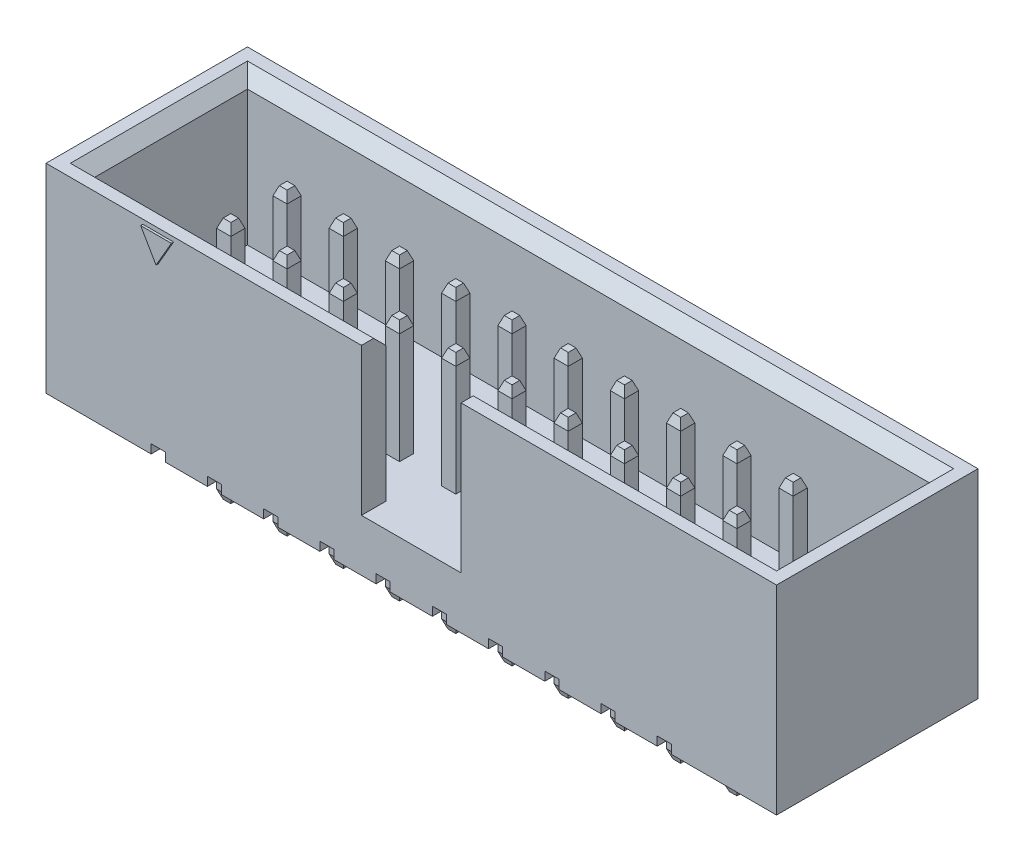
from build123d import *
from OCP.BRepFilletAPI import BRepFilletAPI_MakeChamfer

# Parameters (mm, degrees)
SKETCH1_W                      = 33
SKETCH1_H                      = 9.1
BOSS_EXTRUDE1_DEPTH            = 9
SKETCH2_W                      = 30.8
SKETCH2_H                      = 6.9
CUT_EXTRUDE1_DEPTH             = 6.65
CHAMFER2_SIZE                  = 0.55
CUT_EXTRUDE3_REACH             = 22.882
SKETCH5_W                      = 4.5
SKETCH5_H                      = 6.65
CUT_EXTRUDE3_DIRECTION_2_DEPTH = 21.882049708
SKETCH3_W                      = 0.64
SKETCH3_H                      = 0.64
CUT_EXTRUDE6_DEPTH             = 19.362325561
LPATTERN9_COUNT                = 10
LPATTERN9_PITCH                = 2.54
LPATTERN9_COUNT_DIR2           = 2
LPATTERN9_PITCH_DIR2           = 2.54
BOSS_EXTRUDE3_DEPTH            = 7.75
BOSS_EXTRUDE3_DEPTH_BACK       = 3.25
SKETCH7_W                      = 0.64
SKETCH7_H                      = 0.64
CHAMFER3_SIZE                  = 0.4
CHAMFER3_SIZE2                 = 0.145588094
LPATTERN17_COUNT               = 10
LPATTERN17_PITCH               = 2.54
LPATTERN17_2_COUNT             = 2
LPATTERN17_2_PITCH             = 2.54
SKETCH6_W                      = 0.64
SKETCH6_H                      = 0.4
CUT_EXTRUDE4_DEPTH             = 21.882049708
LPATTERN2_COUNT                = 10
LPATTERN2_PITCH                = 2.54
BOSS_EXTRUDE2_DEPTH            = 0.1


with BuildPart() as part:
    # Sketch1 → Boss-Extrude1 (new body)
    with BuildSketch(Plane(origin=(0, 0, 0), x_dir=(1, 0, 0), z_dir=(0, 1, 0))):
        Rectangle(SKETCH1_W, SKETCH1_H)
    extrude(amount=BOSS_EXTRUDE1_DEPTH)

    # Sketch2 → Cut-Extrude1 (cut)
    with BuildSketch(Plane(origin=(0, 9, 0), x_dir=(1, 0, 0), z_dir=(0, 1, 0))):
        Rectangle(SKETCH2_W, SKETCH2_H)
    extrude(amount=-CUT_EXTRUDE1_DEPTH, mode=Mode.SUBTRACT)

    # Chamfer2
    chamfer2_edges = [part.edges().sort_by_distance(p)[0] for p in [
        (15.4, 9, 0),
        (0, 9, -3.45),
        (-15.4, 9, 0),
        (0, 9, 3.45),
    ]]
    chamfer(chamfer2_edges, length=CHAMFER2_SIZE)

    # Sketch5 → Cut-Extrude3 (cut, up to next)
    with BuildSketch(Plane.XY.offset(4.55), mode=Mode.PRIVATE) as cut_extrude3_sk1:
        with Locations((0, 5.675)):
            Rectangle(SKETCH5_W, SKETCH5_H)
    cut_extrude3_tool1 = extrude(cut_extrude3_sk1.sketch, amount=-CUT_EXTRUDE3_REACH, mode=Mode.PRIVATE) & part.part
    add(cut_extrude3_tool1.solids().sort_by_distance((0, 5.675, 4.55))[0], mode=Mode.SUBTRACT)

    # Sketch5 → Cut-Extrude3 direction 2 (cut)
    with BuildSketch(Plane.XY.offset(4.55)):
        with Locations((0, 5.675)):
            Rectangle(SKETCH5_W, SKETCH5_H)
    extrude(amount=CUT_EXTRUDE3_DIRECTION_2_DEPTH, mode=Mode.SUBTRACT)

    # Sketch3 → Cut-Extrude6 (cut, through all)
    with BuildSketch(Plane(origin=(0, 2.35, 0), x_dir=(1, 0, 0), z_dir=(0, 1, 0))):
        with Locations((-11.43, 1.27)):
            Rectangle(SKETCH3_W, SKETCH3_H)
    cut_extrude6 = extrude(amount=-CUT_EXTRUDE6_DEPTH, mode=Mode.SUBTRACT)

    # LPattern9: Cut-Extrude6 10 × 2
    with Locations(*[(i * LPATTERN9_PITCH, 0, j * LPATTERN9_PITCH_DIR2) for i in range(LPATTERN9_COUNT) for j in range(LPATTERN9_COUNT_DIR2) if (i, j) != (0, 0)]):
        add(cut_extrude6, mode=Mode.SUBTRACT)

    # Sketch6 → Cut-Extrude4 (cut, through all)
    with BuildSketch(Plane.XY.offset(4.55)):
        with Locations((-11.43, 0.2)):
            Rectangle(SKETCH6_W, SKETCH6_H)
    cut_extrude4 = extrude(amount=-CUT_EXTRUDE4_DEPTH, mode=Mode.SUBTRACT)

    # LPattern2: Cut-Extrude4 ×10
    with Locations(*[(i * LPATTERN2_PITCH, 0, 0) for i in range(1, LPATTERN2_COUNT)]):
        add(cut_extrude4, mode=Mode.SUBTRACT)

    # Sketch4 → Boss-Extrude2 (add)
    with BuildSketch(Plane.XY.offset(4.55)):
        Polygon((-12.122820323, 8.8), (-10.737179677, 8.8), (-11.43, 7.6), align=None)
    extrude(amount=BOSS_EXTRUDE2_DEPTH)


with BuildPart() as body_2:
    # Sketch7 → Boss-Extrude3 (new, two sides: drawn at the far end of the back side and taken through both)
    with BuildSketch(Plane(origin=(0, 0, 0), x_dir=(1, 0, 0), z_dir=(0, 1, 0)).offset(-BOSS_EXTRUDE3_DEPTH_BACK)):
        with Locations((-11.43, 1.27)):
            Rectangle(SKETCH7_W, SKETCH7_H)
    extrude(amount=BOSS_EXTRUDE3_DEPTH + BOSS_EXTRUDE3_DEPTH_BACK)

    # Chamfer3: one chamfer whose edges measure the first distance from different faces: ONE call of the kernel's chamfer builder (chamfer() names one face for all edges)
    chamfer3_edges_1 = [body_2.edges().sort_by_distance(p)[0] for p in [
        (-11.75, -3.25, -1.27),
        (-11.75, 7.75, -1.27),
    ]]
    chamfer3_side_1 = [body_2.faces().sort_by_distance(p)[0] for p in [
        (-11.75, 2.25, -1.27),
    ]]
    chamfer3_edges_2 = [body_2.edges().sort_by_distance(p)[0] for p in [
        (-11.11, 7.75, -1.27),
        (-11.11, -3.25, -1.27),
    ]]
    chamfer3_side_2 = [body_2.faces().sort_by_distance(p)[0] for p in [
        (-11.11, 2.25, -1.27),
    ]]
    chamfer3_edges_3 = [body_2.edges().sort_by_distance(p)[0] for p in [
        (-11.43, 7.75, -1.59),
        (-11.43, -3.25, -1.59),
    ]]
    chamfer3_side_3 = [body_2.faces().sort_by_distance(p)[0] for p in [
        (-11.43, 2.25, -1.59),
    ]]
    chamfer3_edges_4 = [body_2.edges().sort_by_distance(p)[0] for p in [
        (-11.43, -3.25, -0.95),
        (-11.43, 7.75, -0.95),
    ]]
    chamfer3_side_4 = [body_2.faces().sort_by_distance(p)[0] for p in [
        (-11.43, 2.25, -0.95),
    ]]
    chamfer3 = BRepFilletAPI_MakeChamfer(body_2.part.solid().wrapped)
    for e in chamfer3_edges_1:
        chamfer3.Add(CHAMFER3_SIZE, CHAMFER3_SIZE2, e.wrapped, chamfer3_side_1[0].wrapped)  # the first distance lies on this face
    for e in chamfer3_edges_2:
        chamfer3.Add(CHAMFER3_SIZE, CHAMFER3_SIZE2, e.wrapped, chamfer3_side_2[0].wrapped)  # the first distance lies on this face
    for e in chamfer3_edges_3:
        chamfer3.Add(CHAMFER3_SIZE, CHAMFER3_SIZE2, e.wrapped, chamfer3_side_3[0].wrapped)  # the first distance lies on this face
    for e in chamfer3_edges_4:
        chamfer3.Add(CHAMFER3_SIZE, CHAMFER3_SIZE2, e.wrapped, chamfer3_side_4[0].wrapped)  # the first distance lies on this face
    add(Compound.cast(chamfer3.Shape()), mode=Mode.REPLACE)


with BuildPart() as lpattern17_1:
    # LPattern17: pattern copy
    add(body_2.part.moved(Location(Vector(1, 0, 0) * (1 * LPATTERN17_PITCH))))


with BuildPart() as lpattern17_2:
    # LPattern17: pattern copy
    add(body_2.part.moved(Location(Vector(1, 0, 0) * (2 * LPATTERN17_PITCH))))


with BuildPart() as lpattern17_3:
    # LPattern17: pattern copy
    add(body_2.part.moved(Location(Vector(1, 0, 0) * (3 * LPATTERN17_PITCH))))


with BuildPart() as lpattern17_4:
    # LPattern17: pattern copy
    add(body_2.part.moved(Location(Vector(1, 0, 0) * (4 * LPATTERN17_PITCH))))


with BuildPart() as lpattern17_5:
    # LPattern17: pattern copy
    add(body_2.part.moved(Location(Vector(1, 0, 0) * (5 * LPATTERN17_PITCH))))


with BuildPart() as lpattern17_6:
    # LPattern17: pattern copy
    add(body_2.part.moved(Location(Vector(1, 0, 0) * (6 * LPATTERN17_PITCH))))


with BuildPart() as lpattern17_7:
    # LPattern17: pattern copy
    add(body_2.part.moved(Location(Vector(1, 0, 0) * (7 * LPATTERN17_PITCH))))


with BuildPart() as lpattern17_8:
    # LPattern17: pattern copy
    add(body_2.part.moved(Location(Vector(1, 0, 0) * (8 * LPATTERN17_PITCH))))


with BuildPart() as lpattern17_9:
    # LPattern17: pattern copy
    add(body_2.part.moved(Location(Vector(1, 0, 0) * (9 * LPATTERN17_PITCH))))


with BuildPart() as lpattern17_2_1:
    # LPattern17 2: pattern copy
    add(body_2.part.moved(Location(Vector(0, 0, 1) * (1 * LPATTERN17_2_PITCH))))


with BuildPart() as lpattern17_2_2:
    # LPattern17 2: pattern copy
    add(lpattern17_1.part.moved(Location(Vector(0, 0, 1) * (1 * LPATTERN17_2_PITCH))))


with BuildPart() as lpattern17_2_3:
    # LPattern17 2: pattern copy
    add(lpattern17_2.part.moved(Location(Vector(0, 0, 1) * (1 * LPATTERN17_2_PITCH))))


with BuildPart() as lpattern17_2_4:
    # LPattern17 2: pattern copy
    add(lpattern17_3.part.moved(Location(Vector(0, 0, 1) * (1 * LPATTERN17_2_PITCH))))


with BuildPart() as lpattern17_2_5:
    # LPattern17 2: pattern copy
    add(lpattern17_4.part.moved(Location(Vector(0, 0, 1) * (1 * LPATTERN17_2_PITCH))))


with BuildPart() as lpattern17_2_6:
    # LPattern17 2: pattern copy
    add(lpattern17_5.part.moved(Location(Vector(0, 0, 1) * (1 * LPATTERN17_2_PITCH))))


with BuildPart() as lpattern17_2_7:
    # LPattern17 2: pattern copy
    add(lpattern17_6.part.moved(Location(Vector(0, 0, 1) * (1 * LPATTERN17_2_PITCH))))


with BuildPart() as lpattern17_2_8:
    # LPattern17 2: pattern copy
    add(lpattern17_7.part.moved(Location(Vector(0, 0, 1) * (1 * LPATTERN17_2_PITCH))))


with BuildPart() as lpattern17_2_9:
    # LPattern17 2: pattern copy
    add(lpattern17_8.part.moved(Location(Vector(0, 0, 1) * (1 * LPATTERN17_2_PITCH))))


with BuildPart() as lpattern17_2_10:
    # LPattern17 2: pattern copy
    add(lpattern17_9.part.moved(Location(Vector(0, 0, 1) * (1 * LPATTERN17_2_PITCH))))


solid = Compound([part.part, body_2.part, lpattern17_1.part, lpattern17_2.part, lpattern17_3.part, lpattern17_4.part, lpattern17_5.part, lpattern17_6.part, lpattern17_7.part, lpattern17_8.part, lpattern17_9.part, lpattern17_2_1.part, lpattern17_2_2.part, lpattern17_2_3.part, lpattern17_2_4.part, lpattern17_2_5.part, lpattern17_2_6.part, lpattern17_2_7.part, lpattern17_2_8.part, lpattern17_2_9.part, lpattern17_2_10.part])
